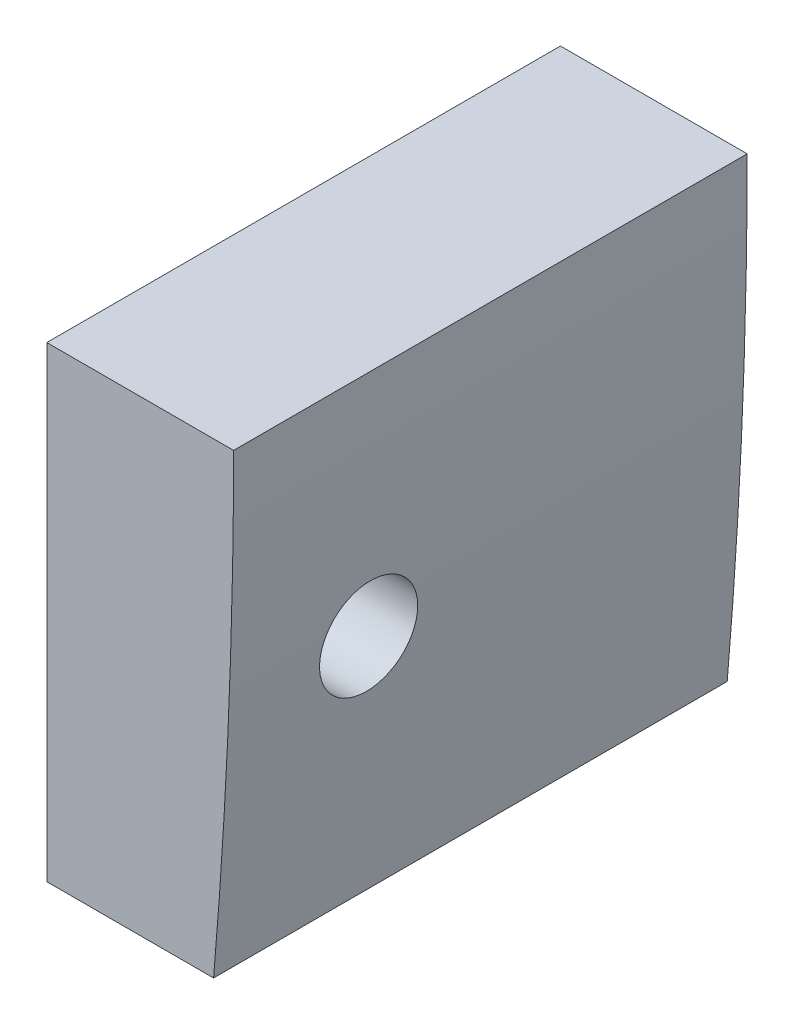
from build123d import *

# Parameters (mm, degrees)
BOSS_EXTRUDE1_DEPTH      = 12
BOSS_EXTRUDE1_DEPTH_BACK = 10
CUT_EXTRUDE1_REACH       = 45.182
CUT_EXTRUDE1_START       = -2
SKETCH2_R                = 2.1


with BuildPart() as part:
    # Sketch1 → Boss-Extrude1 (new, two sides: drawn at the far end of the back side and taken through both)
    with BuildSketch(Plane.XY.offset(-BOSS_EXTRUDE1_DEPTH_BACK)):
        with BuildLine():
            Line((136.481143945, 38.574060338), (128.481143945, 38.574060338))
            Line((128.481143945, 38.574060338), (128.481143945, 18.574060338))
            Line((128.481143945, 18.574060338), (135.625186397, 18.574060338))
            add(Edge.make_bspline(
                [(136.481143945, 38.574060338), (136.479179267, 28.55738944), (135.625186397, 18.574060338)],
                knots=[0, 0, 0, 1, 1, 1], degree=2))
        make_face()
    extrude(amount=BOSS_EXTRUDE1_DEPTH + BOSS_EXTRUDE1_DEPTH_BACK)

    # Sketch2 → Cut-Extrude1 (cut, up to next)
    with BuildSketch(Plane.ZY.offset(-128.481143945).offset(CUT_EXTRUDE1_START), mode=Mode.PRIVATE) as cut_extrude1_sk1:
        with Locations((6, 28.574060338)):
            Circle(SKETCH2_R)
    cut_extrude1_tool1 = extrude(cut_extrude1_sk1.sketch, amount=-CUT_EXTRUDE1_REACH, mode=Mode.PRIVATE) & part.part
    add(cut_extrude1_tool1.solids().sort_by_distance((130.481144, 28.57406, 6))[0], mode=Mode.SUBTRACT)


solid = part.part
